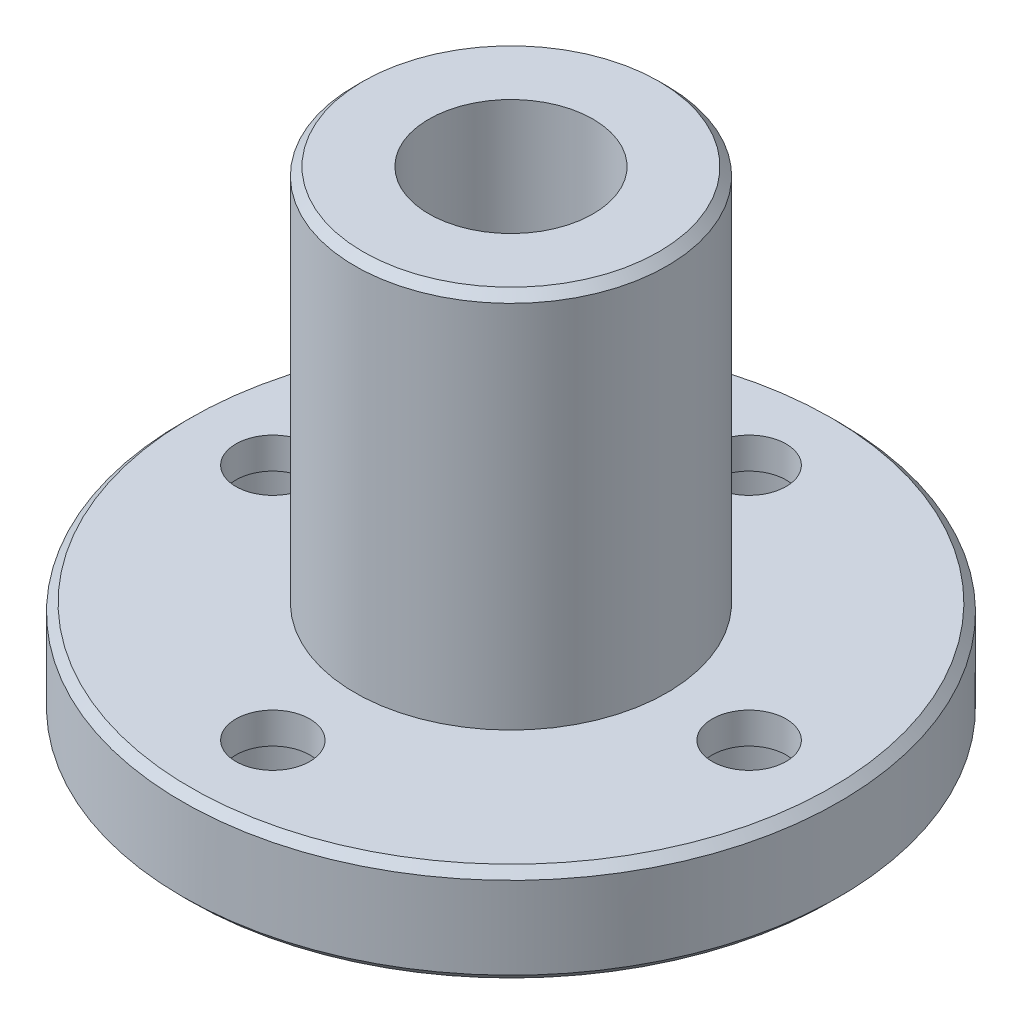
from build123d import *

# Parameters (mm, degrees)
SKETCH_2_R          = 2.25
CUT_EXTRUDE_1_DEPTH = 41.509258201
SKETCH_3_R          = 3.75
CUT_EXTRUDE_2_DEPTH = 4.1
CHAMFER_1_SIZE      = 0.5


with BuildPart() as part:
    # Эскиз1 → Повернуть1 (revolve)
    with BuildSketch(Plane.XY, mode=Mode.PRIVATE) as revolve_1_sk:
        Polygon((-5, 0), (-20, 0), (-20, 6), (-9.5, 6), (-9.5, 29), (-5, 29), align=None)
    revolve(revolve_1_sk.sketch.rotate(Axis((0, 0, 0), (0, 1, 0)), 270), axis=Axis((0, 0, 0), (0, 1, 0)))

    # Эскиз2 → Вырез-Вытянуть1 (cut, through all)
    with BuildSketch(Plane.XZ):
        with Locations(Location((0, 14.5, 0), (0, 0, 270))):
            Circle(SKETCH_2_R)
        with Locations(Location((14.5, 0, 0), (0, 0, 270))):
            Circle(SKETCH_2_R)
        with Locations(Location((0, -14.5, 0), (0, 0, 270))):
            Circle(SKETCH_2_R)
        with Locations(Location((-14.5, 0, 0), (0, 0, 270))):
            Circle(SKETCH_2_R)
    extrude(amount=-CUT_EXTRUDE_1_DEPTH, mode=Mode.SUBTRACT)

    # Эскиз3 → Вырез-Вытянуть2 (cut)
    with BuildSketch(Plane.XZ):
        with Locations(Location((0, 14.5, 0), (0, 0, 270))):
            Circle(SKETCH_3_R)
        with Locations(Location((14.5, 0, 0), (0, 0, 270))):
            Circle(SKETCH_3_R)
        with Locations(Location((0, -14.5, 0), (0, 0, 270))):
            Circle(SKETCH_3_R)
        with Locations(Location((-14.5, 0, 0), (0, 0, 270))):
            Circle(SKETCH_3_R)
    extrude(amount=-CUT_EXTRUDE_2_DEPTH, mode=Mode.SUBTRACT)

    # Фаска1
    chamfer_1_edges = [part.edges().sort_by_distance(p)[0] for p in [
        (0, 29, 9.5),
        (0, 6, 20),
        (0, 0, 20),
    ]]
    chamfer(chamfer_1_edges, length=CHAMFER_1_SIZE)


solid = part.part
